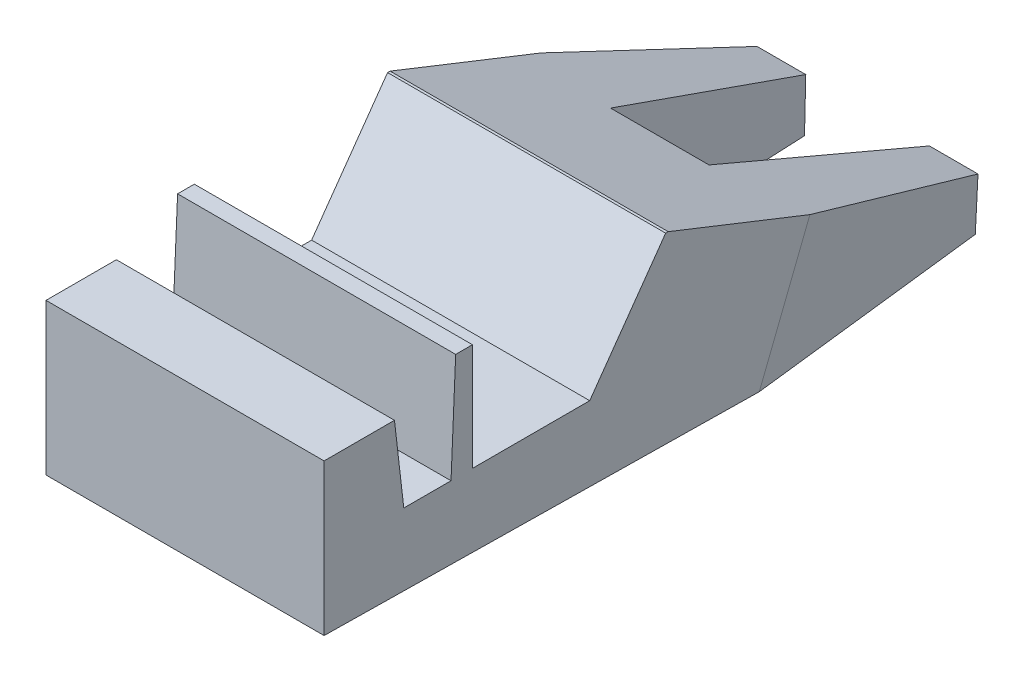
from build123d import *

# Parameters (mm, degrees)
SKETCH_1_W           = 195.008255005
SKETCH_1_H           = 479.009395123
EXTRUDE_2_DEPTH      = 135
CUT_EXTRUDE_4_DEPTH  = 200
CUT_EXTRUDE_23_DEPTH = 200


with BuildPart() as part:
    # Эскиз1 → Бобышка-Вытянуть2 (new body)
    with BuildSketch(Plane(origin=(0, 0, 0), x_dir=(1, 0, 0), z_dir=(0, 1, 0))):
        with Locations((97.504127503, 243.967165232)):
            Rectangle(SKETCH_1_W, SKETCH_1_H)
    extrude(amount=EXTRUDE_2_DEPTH)

    # Эскиз3 → Вырез-Вытянуть4 (cut)
    with BuildSketch(Plane.ZY):
        Polygon((-483.471862793, 40.937199902), (-245.760530455, 135), (-483.471862793, 135), align=None)
        Polygon((-108.474701812, 135), (-243.967165232, 135), (-190.717834923, 59.88686474), (-108.474701812, 59.88686474), align=None)
        Polygon((-4.46246767, 135), (-96.73151757, 135), (-93.463282811, 59.88686474), (-60.345170592, 59.88686474), (-53.808701075, 116.435636272), (-4.46246767, 116.435636272), align=None)
        Polygon((-4.46246767, 10.364015235), (-483.471862793, 3.305962882), (-483.471862793, 0), (-4.46246767, 0), align=None)
    extrude(amount=-CUT_EXTRUDE_4_DEPTH, mode=Mode.SUBTRACT)

    # Эскиз4 → Вырез-Вытянуть23 (cut)
    with BuildSketch(Plane(origin=(0, 200.805738218, -79.459190383), x_dir=(1, 0, 0), z_dir=(0, 0.9298484645549542, -0.3679427033721343))):
        Polygon((53.747628165, 434.493025273), (140.455159465, 434.493025273), (143.17020938, 491.267849843), (50.129149916, 491.267849843), align=None)
        Polygon((132.896060194, 276.42354275), (140.455159465, 434.493025273), (53.747628165, 434.493025273), (63.82200512, 276.42354275), align=None)
        Polygon((0, 434.493025273), (19.603729829, 434.493025273), (27.465109106, 491.267849843), (0, 491.267849843), align=None)
        Polygon((0, 434.493025273), (0, 292.915029518), (19.603729829, 434.493025273), align=None)
        Polygon((174.530095187, 434.493025273), (195.008255005, 285.726840395), (195.008255005, 434.493025273), align=None)
        Polygon((174.477407826, 434.875779277), (174.530095187, 434.493025273), (195.008255005, 434.493025273), (195.008255005, 491.267849843), (166.714851877, 491.267849843), align=None)
    extrude(amount=-CUT_EXTRUDE_23_DEPTH, mode=Mode.SUBTRACT)


solid = part.part
